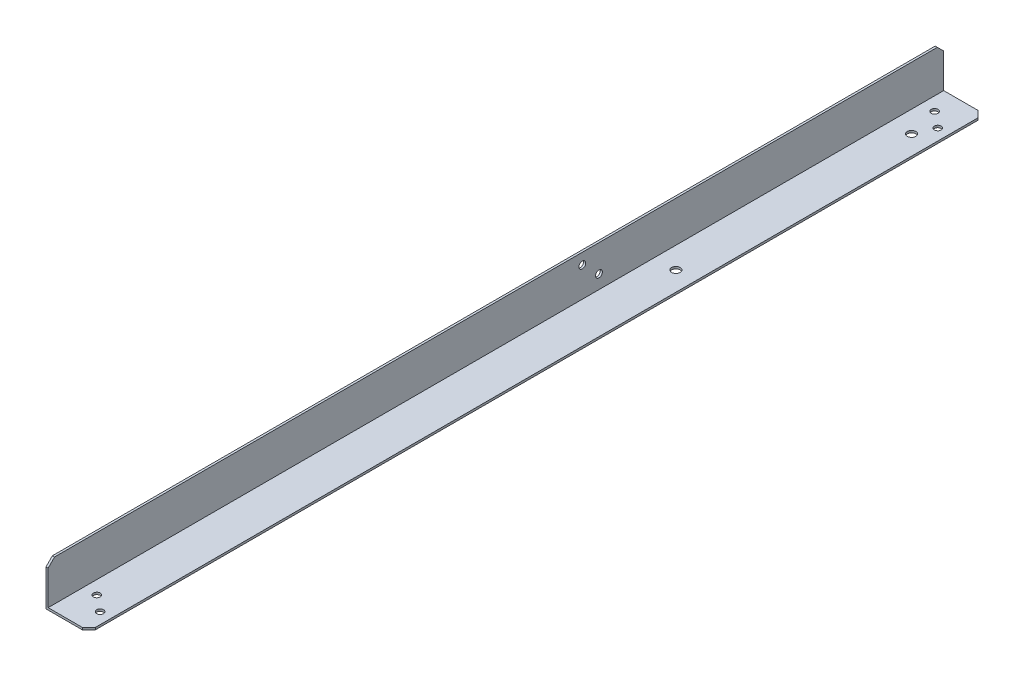
from build123d import *

# Parameters (mm, degrees)
BASE_DEPTH                      = 418
CHAMFER1_SIZE                   = 3
F_3_2_3_2_CABLE_CARRIER_HOLES_D = 3.2
F_3_2_3_2_DIAMETER_HOLE2_D      = 3.2
F_4_0_4_CABLE_TIE_HOLES_D       = 4


with BuildPart() as part:
    # Sketch1 → Base (new body)
    with BuildSketch(Plane.XY):
        Polygon((0, 0), (20, 0), (20, 1), (1, 1), (1, 20), (0, 20), align=None)
    extrude(amount=BASE_DEPTH)

    # Chamfer1
    chamfer1_edges = [part.edges().sort_by_distance(p)[0] for p in [
        (20, 0.5, 418),
        (0.5, 20, 418),
        (0.5, 20, 0),
        (20, 0.5, 0),
    ]]
    chamfer(chamfer1_edges, length=CHAMFER1_SIZE)

    # Ø3.2 (3.2) Cable Carrier Holes (through all)
    with Locations(Plane(origin=(1, 0, 0), x_dir=(0, 0, -1), z_dir=(1, 0, 0))):
        with Locations((-168.7, 14.85), (-160.9, 7.35)):
            Hole(F_3_2_3_2_CABLE_CARRIER_HOLES_D / 2)

    # Ø3.2 (3.2) Diameter Hole2 (through all)
    with Locations(Plane(origin=(0, 1, 0), x_dir=(1, 0, 0), z_dir=(0, 1, 0))):
        with Locations((7.25, -401.5), (14.75, -407.5), (7.25, -10.5), (14.75, -16.5)):
            Hole(F_3_2_3_2_DIAMETER_HOLE2_D / 2)

    # Ø4.0 (4) Cable Tie Holes (through all)
    with Locations(Plane(origin=(0, 1, 0), x_dir=(1, 0, 0), z_dir=(0, 1, 0))):
        with Locations((11, -25), (11, -135)):
            Hole(F_4_0_4_CABLE_TIE_HOLES_D / 2)


solid = part.part
